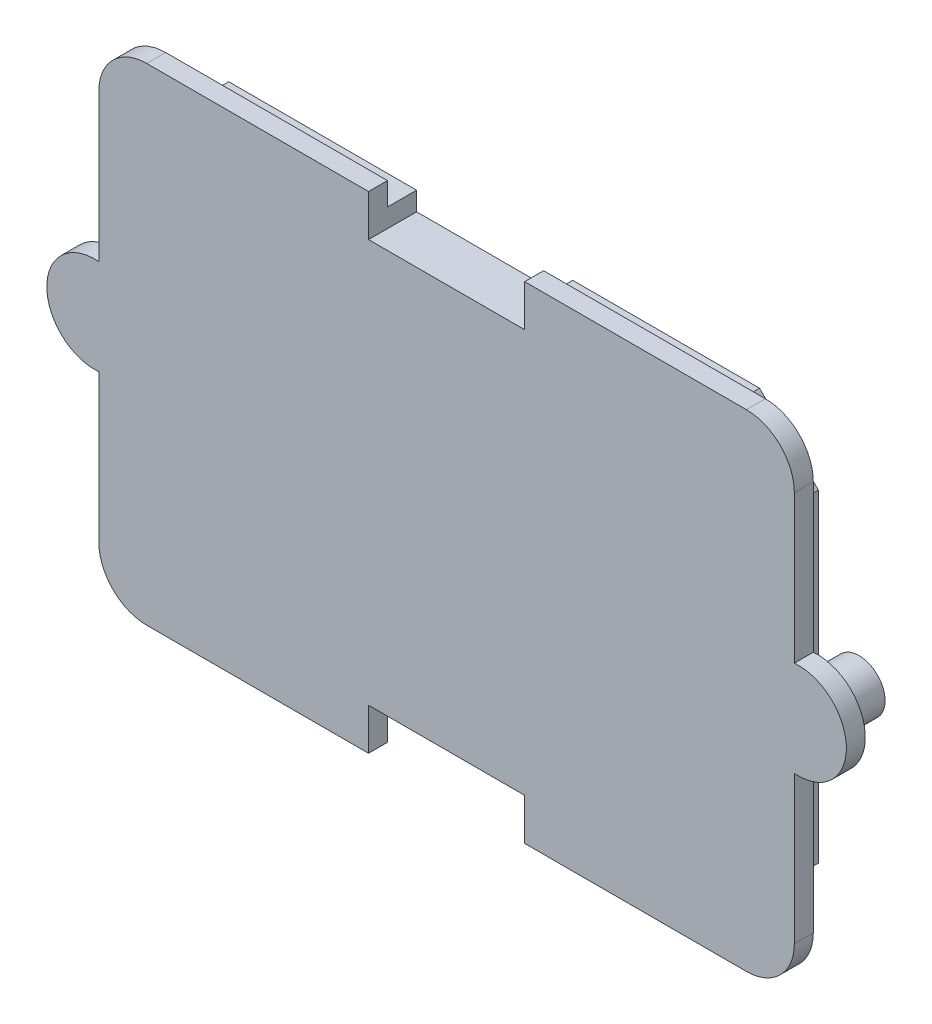
from build123d import *

# Parameters (mm, degrees)
BOSS_EXTRUDE1_DEPTH = 1.5875
SKETCH3_W           = 9.525
SKETCH3_H           = 2.54
CUT_EXTRUDE1_DEPTH  = 29.598819744
SKETCH4_R           = 1.5875
BOSS_EXTRUDE2_DEPTH = 2.54
BOSS_EXTRUDE3_DEPTH = 1.778
SKETCH6_W           = 48.787
SKETCH6_H           = 0.4318
CUT_EXTRUDE2_DEPTH  = 19.05


with BuildPart() as part:
    # Sketch2 → Boss-Extrude1 (new body)
    with BuildSketch(Plane.XY):
        with BuildLine():
            Line((21.2185, 2.909935566), (21.2185, 11.9225))
            ThreePointArc((21.2185, 11.9225), (20.362958908, 13.987958908), (18.2975, 14.8435))
            Line((18.2975, 14.8435), (-18.2975, 14.8435))
            ThreePointArc((-18.2975, 14.8435), (-20.362958908, 13.987958908), (-21.2185, 11.9225))
            Line((-21.2185, 11.9225), (-21.2185, 2.909935566))
            ThreePointArc((-21.2185, 2.909935566), (-24.3935, 0), (-21.2185, -2.909935566))
            Line((-21.2185, -2.909935566), (-21.2185, -11.9225))
            ThreePointArc((-21.2185, -11.9225), (-20.362958908, -13.987958908), (-18.2975, -14.8435))
            Line((-18.2975, -14.8435), (18.2975, -14.8435))
            ThreePointArc((18.2975, -14.8435), (20.362958908, -13.987958908), (21.2185, -11.9225))
            Line((21.2185, -11.9225), (21.2185, -2.909935566))
            ThreePointArc((21.2185, -2.909935566), (24.3935, 0), (21.2185, 2.909935566))
        make_face()
    extrude(amount=BOSS_EXTRUDE1_DEPTH)

    # Sketch3 → Cut-Extrude1 (cut, through all)
    with BuildSketch(Plane.XY.offset(1.5875)):
        with Locations((0, -13.5735)):
            Rectangle(SKETCH3_W, SKETCH3_H)
        with Locations((0, 13.5735)):
            Rectangle(SKETCH3_W, SKETCH3_H)
    extrude(amount=-CUT_EXTRUDE1_DEPTH, mode=Mode.SUBTRACT)

    # Sketch4 → Boss-Extrude2 (add)
    with BuildSketch(Plane(origin=(0, 0, 0), x_dir=(-1, 0, 0), z_dir=(0, 0, -1))):
        with Locations(Location((-21.4725, 0, 0), (0, 0, 180))):
            Circle(SKETCH4_R)
        with Locations(Location((21.4725, 0, 0), (0, 0, 180))):
            Circle(SKETCH4_R)
    extrude(amount=BOSS_EXTRUDE2_DEPTH)

    # Sketch5 → Boss-Extrude3 (add)
    with BuildSketch(Plane(origin=(0, 0, 0), x_dir=(-1, 0, 0), z_dir=(0, 0, -1))):
        Polygon((-19.757999981, 9.854397583), (-16.165897533, 13.446500031), (-4.7625, 13.446500031), (-4.7625, 12.3035), (4.7625, 12.3035), (4.7625, 13.446500031), (16.229397533, 13.446500031), (19.821499981, 9.854397583), (19.821499981, -9.854397583), (16.229397533, -13.446500031), (4.7625, -13.446500031), (4.7625, -12.3035), (-4.7625, -12.3035), (-4.7625, -13.446500031), (-16.165897533, -13.446500031), (-19.757999981, -9.854397583), align=None)
    extrude(amount=BOSS_EXTRUDE3_DEPTH)

    # Sketch6 → Cut-Extrude2 (cut, symmetric)
    with BuildSketch(Plane(origin=(0, 0, 0), x_dir=(1, 0, 0), z_dir=(0, 1, 0))):
        with Locations((0, -1.3716)):
            Rectangle(SKETCH6_W, SKETCH6_H)
    extrude(amount=CUT_EXTRUDE2_DEPTH, both=True, mode=Mode.SUBTRACT)


solid = part.part
